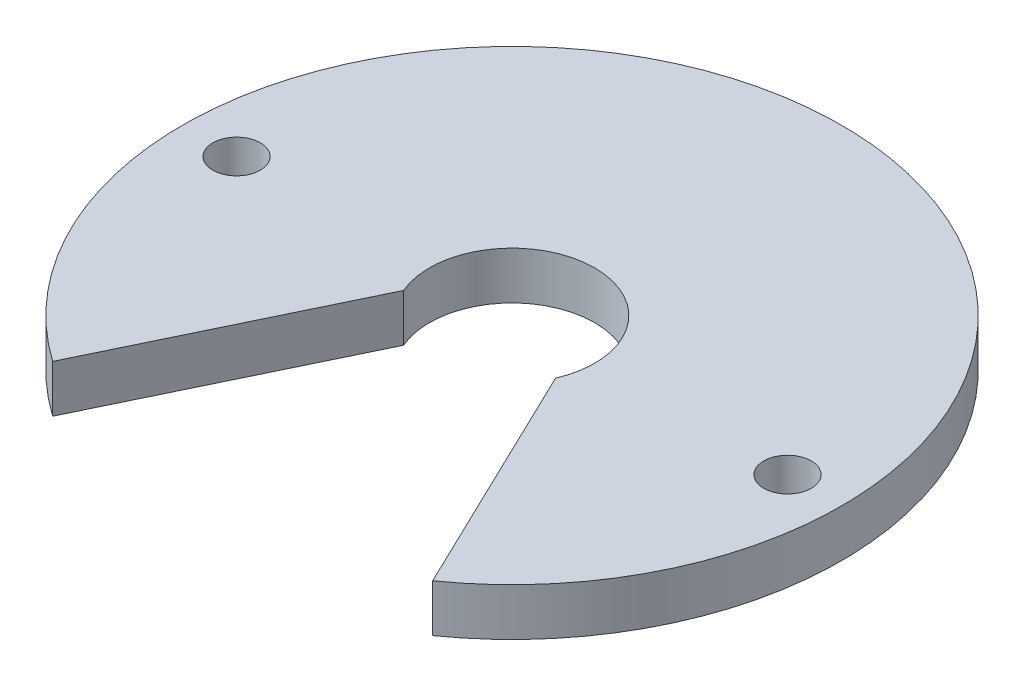
from build123d import *

# Parameters (mm, degrees)
SKETCH1_R           = 17.35
BOSS_EXTRUDE1_DEPTH = 2.5
SKETCH2_R           = 4.35
CUT_EXTRUDE1_DEPTH  = 25.663637201
SKETCH3_R           = 1.25
CUT_EXTRUDE2_DEPTH  = 25.663637201
CUT_EXTRUDE3_DEPTH  = 25.663637201


with BuildPart() as part:
    # Sketch1 → Boss-Extrude1 (new body)
    with BuildSketch(Plane(origin=(0, 0, 0), x_dir=(1, 0, 0), z_dir=(0, 1, 0))):
        with Locations(Location((0, 0, 0), (0, 0, 270))):
            Circle(SKETCH1_R)
    extrude(amount=BOSS_EXTRUDE1_DEPTH)

    # Sketch2 → Cut-Extrude1 (cut, through all)
    with BuildSketch(Plane(origin=(0, 2.5, 0), x_dir=(1, 0, 0), z_dir=(0, 1, 0))):
        with Locations(Location((0, 0, 0), (0, 0, 270))):
            Circle(SKETCH2_R)
    extrude(amount=-CUT_EXTRUDE1_DEPTH, mode=Mode.SUBTRACT)

    # Sketch3 → Cut-Extrude2 (cut, through all)
    with BuildSketch(Plane(origin=(0, 2.5, 0), x_dir=(1, 0, 0), z_dir=(0, 1, 0))):
        with Locations(Location((-14.5, 0, 0), (0, 0, 270))):
            Circle(SKETCH3_R)
        with Locations(Location((14.5, 0, 0), (0, 0, 270))):
            Circle(SKETCH3_R)
    extrude(amount=-CUT_EXTRUDE2_DEPTH, mode=Mode.SUBTRACT)

    # Sketch4 → Cut-Extrude3 (cut, through all)
    with BuildSketch(Plane(origin=(0, 2.5, 0), x_dir=(1, 0, 0), z_dir=(0, 1, 0))):
        with BuildLine():
            Line((-4, -1.7095321), (-10, -14.17824037))
            ThreePointArc((-10, -14.17824037), (0, -17.35), (10, -14.17824037))
            Line((10, -14.17824037), (4, -1.7095321))
            ThreePointArc((4, -1.7095321), (0, -4.35), (-4, -1.7095321))
        make_face()
    extrude(amount=-CUT_EXTRUDE3_DEPTH, mode=Mode.SUBTRACT)


solid = part.part
